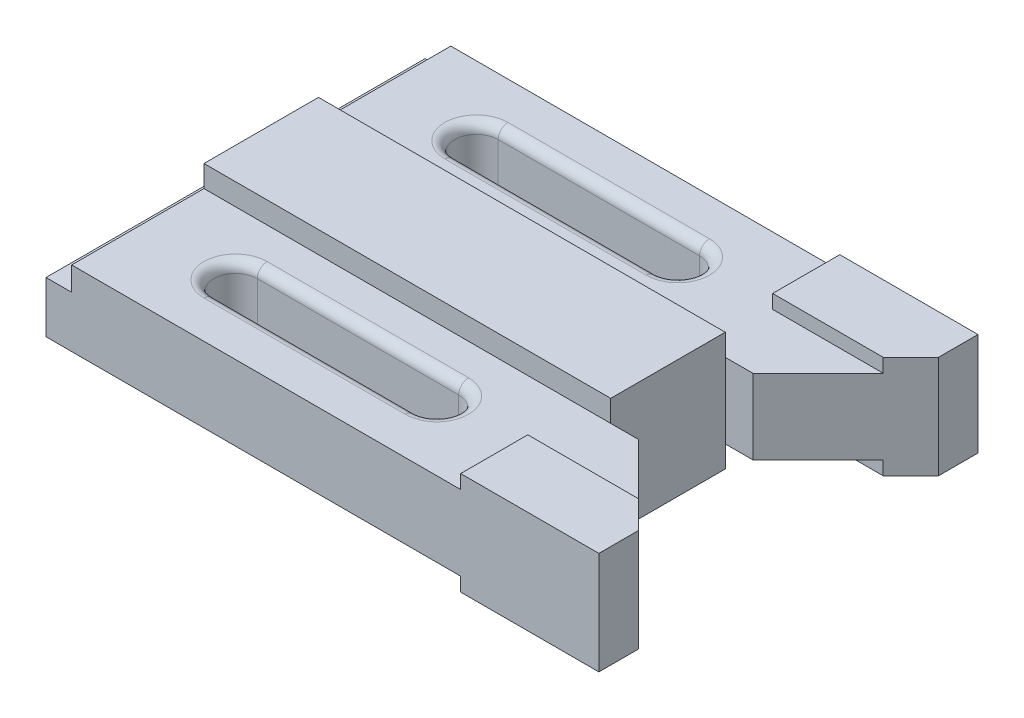
from build123d import *

# Parameters (mm, degrees)
SKETCH1_W           = 109.5
SKETCH1_H           = 14.5
BOSS_EXTRUDE5_DEPTH = 15
BOSS_EXTRUDE6_DEPTH = 9.5
BOSS_EXTRUDE8_DEPTH = 13
SKETCH4_W           = 6.5
SKETCH4_H           = 11.5
CUT_EXTRUDE3_DEPTH  = 65.5
FILLET2_R           = 2.5


with BuildPart() as part:
    # Sketch1 → Boss-Extrude5 (new, symmetric)
    with BuildSketch(Plane(origin=(0, 0, 0), x_dir=(1, 0, 0), z_dir=(0, 1, 0))):
        with Locations((54.75, -40.75)):
            Rectangle(SKETCH1_W, SKETCH1_H)
    extrude(amount=BOSS_EXTRUDE5_DEPTH, both=True)

    # Sketch1<3> → Boss-Extrude6 (add, symmetric)
    with BuildSketch(Plane(origin=(0, 0, 0), x_dir=(1, 0, 0), z_dir=(0, 1, 0))):
        Polygon((105, 0), (0, 0), (0, -33.5), (109.5, -33.5), (116.5, -33.5), (133, -17), (105, -17), align=None)
        with BuildLine():
            ThreePointArc((30.5, -23), (25, -17.5), (30.5, -12))
            Line((30.5, -12), (81.5, -12))
            ThreePointArc((81.5, -12), (87, -17.5), (81.5, -23))
            Line((81.5, -23), (30.5, -23))
        make_face(mode=Mode.SUBTRACT)
    extrude(amount=BOSS_EXTRUDE6_DEPTH, both=True)

    # Sketch1<5> → Boss-Extrude8 (add, symmetric)
    with BuildSketch(Plane(origin=(0, 0, 0), x_dir=(1, 0, 0), z_dir=(0, 1, 0))):
        Polygon((140, 0), (105, 0), (105, -17), (133, -17), (140, -10), align=None)
    extrude(amount=BOSS_EXTRUDE8_DEPTH, both=True)

    # Sketch4 → Cut-Extrude3 (cut, symmetric)
    with BuildSketch(Plane(origin=(0, 0, 0), x_dir=(-1, 0, 0), z_dir=(0, 0, -1))):
        with Locations((-3.25, 9.25)):
            Rectangle(SKETCH4_W, SKETCH4_H)
    extrude(amount=CUT_EXTRUDE3_DEPTH, both=True, mode=Mode.SUBTRACT)

    # Fillet2
    fillet2_edges = [part.edges().sort_by_distance(p)[0] for p in [
        (87, -9.5, 17.5),
        (56, -9.5, 12),
        (25, -9.5, 17.5),
        (56, -9.5, 23),
        (25, 9.5, 17.5),
        (56, 9.5, 23),
        (56, 9.5, 12),
        (87, 9.5, 17.5),
    ]]
    fillet(fillet2_edges, radius=FILLET2_R)

    # Mirror2: part across plane


with BuildPart() as part_1:
    add(part.part)
    add(part.part.mirror(Plane(origin=(0, 15, 48), x_dir=(1, 0, 0), z_dir=(0, 0, -1))))


solid = part_1.part
